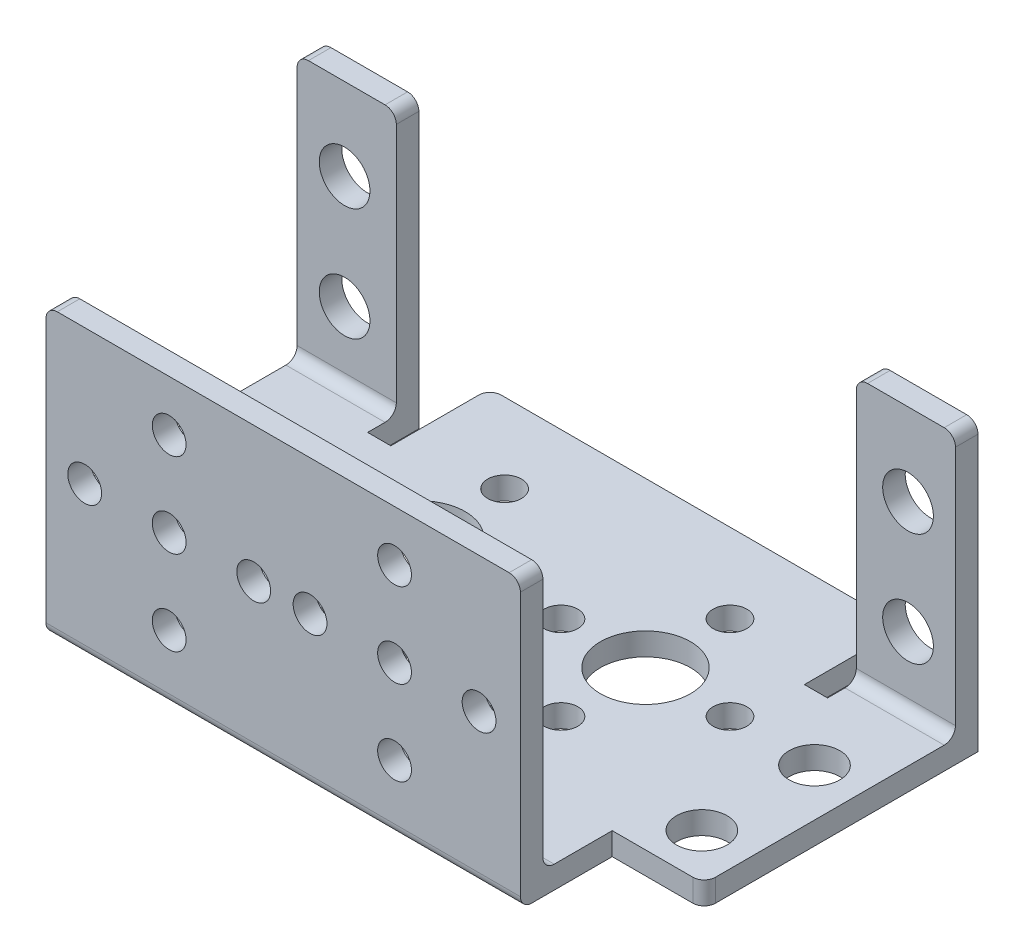
from build123d import *

# Parameters (mm, degrees)
SKETCH2_W           = 58.42
SKETCH2_H           = 25.4
BOSS_EXTRUDE1_DEPTH = 36.7
CUT_EXTRUDE1_REACH  = 75.518
SKETCH3_W           = 4.252
SKETCH3_H           = 23.4
SKETCH3_W_2         = 28.448
SKETCH4_W           = 8.16
SKETCH4_H           = 23.4
CUT_EXTRUDE3_DEPTH  = 2
FILLET1_R           = 1
CUT_EXTRUDE5_REACH  = 73.491
SKETCH5_W           = 40.82
SKETCH5_H           = 23.4
SKETCH6_W           = 2.06
SKETCH6_H           = 2.548
CUT_EXTRUDE6_DEPTH  = 2
CUT_EXTRUDE7_DEPTH  = 2
FILLET2_R           = 1
SKETCH8_R           = 1.5
CUT_EXTRUDE8_DEPTH  = 2
SKETCH9_R           = 2.25
SKETCH9_R_2         = 4
SKETCH9_R_3         = 1.5
CUT_EXTRUDE9_DEPTH  = 2
SKETCH10_R          = 2.25
CUT_EXTRUDE10_DEPTH = 2
FILLET3_R           = 1


with BuildPart() as part:
    # Sketch2 → Boss-Extrude1 (new body)
    with BuildSketch(Plane.XY):
        with Locations((29.21, 12.7)):
            Rectangle(SKETCH2_W, SKETCH2_H)
    extrude(amount=BOSS_EXTRUDE1_DEPTH)

    # Sketch3 → Cut-Extrude1 (cut, up to next)
    with BuildSketch(Plane(origin=(58.42, 0, 0), x_dir=(0, 0, -1), z_dir=(1, 0, 0)), mode=Mode.PRIVATE) as cut_extrude1_sk1:
        with Locations((-2.126, 13.7)):
            Rectangle(SKETCH3_W, SKETCH3_H)
    cut_extrude1_tool1 = extrude(cut_extrude1_sk1.sketch, amount=-CUT_EXTRUDE1_REACH, mode=Mode.PRIVATE) & part.part
    # Sketch3 → Cut-Extrude1 (cut, up to next)
    with BuildSketch(Plane(origin=(58.42, 0, 0), x_dir=(0, 0, -1), z_dir=(1, 0, 0)), mode=Mode.PRIVATE) as cut_extrude1_sk2:
        with Locations((-20.476, 13.7)):
            Rectangle(SKETCH3_W_2, SKETCH3_H)
    cut_extrude1_tool2 = extrude(cut_extrude1_sk2.sketch, amount=-CUT_EXTRUDE1_REACH, mode=Mode.PRIVATE) & part.part
    add(cut_extrude1_tool1.solids().sort_by_distance((58.42, 13.7, 2.126))[0], mode=Mode.SUBTRACT)
    add(cut_extrude1_tool2.solids().sort_by_distance((58.42, 13.7, 20.476))[0], mode=Mode.SUBTRACT)

    # Sketch4 → Cut-Extrude3 (cut)
    with BuildSketch(Plane.XY.offset(36.7)):
        with Locations((4.08, 13.7)):
            Rectangle(SKETCH4_W, SKETCH4_H)
        with Locations((54.34, 13.7)):
            Rectangle(SKETCH4_W, SKETCH4_H)
    extrude(amount=-CUT_EXTRUDE3_DEPTH, mode=Mode.SUBTRACT)

    # Fillet1
    fillet1_edges = [part.edges().sort_by_distance(p)[0] for p in [
        (29.21, 2, 34.7),
        (8.16, 25.4, 35.7),
        (50.26, 25.4, 35.7),
        (29.21, 0, 36.7),
    ]]
    fillet(fillet1_edges, radius=FILLET1_R)

    # Sketch5 → Cut-Extrude5 (cut, up to next)
    with BuildSketch(Plane(origin=(0, 0, 4.252), x_dir=(-1, 0, 0), z_dir=(0, 0, -1)), mode=Mode.PRIVATE) as cut_extrude5_sk1:
        with Locations((-29.21, 13.7)):
            Rectangle(SKETCH5_W, SKETCH5_H)
    cut_extrude5_tool1 = extrude(cut_extrude5_sk1.sketch, amount=-CUT_EXTRUDE5_REACH, mode=Mode.PRIVATE) & part.part
    add(cut_extrude5_tool1.solids().sort_by_distance((29.21, 13.7, 4.252))[0], mode=Mode.SUBTRACT)

    # Sketch6 → Cut-Extrude6 (cut)
    with BuildSketch(Plane(origin=(0, 2, 0), x_dir=(1, 0, 0), z_dir=(0, 1, 0))):
        Polygon((10.86, -6.252), (10.86, 0), (0, 0), (0, -4.252), (8.8, -4.252), (8.8, -6.252), align=None)
        Polygon((58.42, 0), (47.56, 0), (47.56, -6.252), (49.62, -6.252), (49.62, -4.252), (58.42, -4.252), align=None)
        with Locations((48.59, -7.526)):
            Rectangle(SKETCH6_W, SKETCH6_H)
        with Locations((9.83, -7.526)):
            Rectangle(SKETCH6_W, SKETCH6_H)
    extrude(amount=-CUT_EXTRUDE6_DEPTH, mode=Mode.SUBTRACT)

    # Sketch7 → Cut-Extrude7 (cut)
    with BuildSketch(Plane(origin=(0, 2, 0), x_dir=(1, 0, 0), z_dir=(0, 1, 0))):
        Polygon((0, -36.7), (8.16, -36.7), (8.16, -33.7), (8.16, -28.552), (0, -28.552), align=None)
        Polygon((58.42, -36.7), (58.42, -28.552), (50.26, -28.552), (50.26, -33.7), (50.26, -36.7), align=None)
    extrude(amount=-CUT_EXTRUDE7_DEPTH, mode=Mode.SUBTRACT)

    # Fillet2
    fillet2_edges = [part.edges().sort_by_distance(p)[0] for p in [
        (49.62, 25.4, 5.252),
        (8.8, 25.4, 5.252),
        (47.56, 1, 0),
        (10.86, 1, 0),
        (0, 1, 28.552),
        (58.42, 1, 28.552),
        (58.42, 25.4, 5.252),
        (0, 25.4, 5.252),
    ]]
    fillet(fillet2_edges, radius=FILLET2_R)

    # Sketch8 → Cut-Extrude8 (cut)
    with BuildSketch(Plane.XY.offset(36.7)):
        with Locations((19.091571086, 13.4)):
            Circle(SKETCH8_R)
        with Locations((19.091571086, 20.9)):
            Circle(SKETCH8_R)
        with Locations((26.591571086, 13.4)):
            Circle(SKETCH8_R)
        with Locations((19.091571086, 5.9)):
            Circle(SKETCH8_R)
        with Locations((11.591571086, 13.4)):
            Circle(SKETCH8_R)
        with Locations((39.091571086, 13.4)):
            Circle(SKETCH8_R)
        with Locations((39.091571086, 5.9)):
            Circle(SKETCH8_R)
        with Locations((31.591571086, 13.4)):
            Circle(SKETCH8_R)
        with Locations((39.091571086, 20.9)):
            Circle(SKETCH8_R)
        with Locations((46.591571086, 13.4)):
            Circle(SKETCH8_R)
    extrude(amount=-CUT_EXTRUDE8_DEPTH, mode=Mode.SUBTRACT)

    # Sketch9 → Cut-Extrude9 (cut)
    with BuildSketch(Plane(origin=(0, 2, 0), x_dir=(1, 0, 0), z_dir=(0, 1, 0))):
        with Locations(Location((4.21, -14.552, 0), (0, 0, 270))):
            Circle(SKETCH9_R)
        with Locations(Location((4.21, -24.552, 0), (0, 0, 270))):
            Circle(SKETCH9_R)
        with Locations(Location((54.21, -14.552, 0), (0, 0, 270))):
            Circle(SKETCH9_R)
        with Locations(Location((54.21, -24.552, 0), (0, 0, 270))):
            Circle(SKETCH9_R)
        with Locations(Location((29.21, -24.552, 0), (0, 0, 270))):
            Circle(SKETCH9_R_2)
        with Locations(Location((29.21, -17.052, 0), (0, 0, 270))):
            Circle(SKETCH9_R_3)
        with Locations(Location((36.71, -24.552, 0), (0, 0, 270))):
            Circle(SKETCH9_R_3)
        with Locations(Location((29.21, -32.052, 0), (0, 0, 270))):
            Circle(SKETCH9_R_3)
        with Locations(Location((21.71, -24.552, 0), (0, 0, 270))):
            Circle(SKETCH9_R_3)
        with Locations(Location((39.21, -14.552, 0), (0, 0, 270))):
            Circle(SKETCH9_R_2)
        with Locations(Location((19.21, -14.552, 0), (0, 0, 270))):
            Circle(SKETCH9_R_2)
        with Locations(Location((31.71, -14.552, 0), (0, 0, 270))):
            Circle(SKETCH9_R_3)
        with Locations(Location((39.21, -7.052, 0), (0, 0, 270))):
            Circle(SKETCH9_R_3)
        with Locations(Location((46.71, -14.552, 0), (0, 0, 270))):
            Circle(SKETCH9_R_3)
        with Locations(Location((39.21, -22.052, 0), (0, 0, 270))):
            Circle(SKETCH9_R_3)
        with Locations(Location((26.71, -14.552, 0), (0, 0, 270))):
            Circle(SKETCH9_R_3)
        with Locations(Location((19.21, -22.052, 0), (0, 0, 270))):
            Circle(SKETCH9_R_3)
        with Locations(Location((11.71, -14.552, 0), (0, 0, 270))):
            Circle(SKETCH9_R_3)
        with Locations(Location((19.21, -7.052, 0), (0, 0, 270))):
            Circle(SKETCH9_R_3)
    extrude(amount=-CUT_EXTRUDE9_DEPTH, mode=Mode.SUBTRACT)

    # Sketch10 → Cut-Extrude10 (cut)
    with BuildSketch(Plane(origin=(0, 0, 4.252), x_dir=(-1, 0, 0), z_dir=(0, 0, -1))):
        with Locations(Location((-4.21, 18.11, 0), (0, 0, 90))):
            Circle(SKETCH10_R)
        with Locations(Location((-54.21, 18.11, 0), (0, 0, 90))):
            Circle(SKETCH10_R)
        with Locations(Location((-54.21, 8.11, 0), (0, 0, 90))):
            Circle(SKETCH10_R)
        with Locations(Location((-4.21, 8.11, 0), (0, 0, 90))):
            Circle(SKETCH10_R)
    extrude(amount=-CUT_EXTRUDE10_DEPTH, mode=Mode.SUBTRACT)

    # Fillet3
    fillet3_edges = [part.edges().sort_by_distance(p)[0] for p in [
        (54.02, 2, 6.252),
        (4.4, 2, 6.252),
    ]]
    fillet(fillet3_edges, radius=FILLET3_R)


solid = part.part
